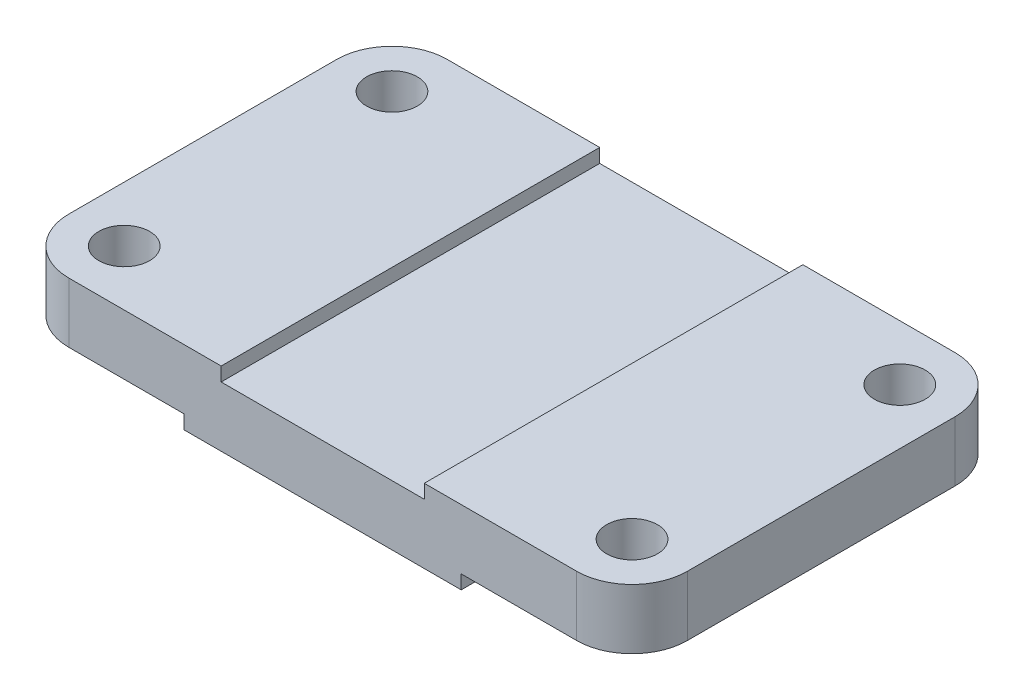
from build123d import *

# Parameters (mm, degrees)
EXTRUSION1_DEPTH   = 41
CONG_1_R           = 12
D_GAGEMENT_M1_61_D = 11


with BuildPart() as part:
    # Esquisse1 → Extrusion1 (new, symmetric)
    with BuildSketch(Plane.XY):
        Polygon((22, 16), (67, 16), (67, 3), (30, 3), (30, 0), (-30, 0), (-30, 3), (-67, 3), (-67, 16), (-22, 16), (-22, 13), (22, 13), align=None)
    extrude(amount=EXTRUSION1_DEPTH, both=True)

    # Congé1
    cong_1_edges = [part.edges().sort_by_distance(p)[0] for p in [
        (67, 9.5, -41),
        (-67, 9.5, -41),
        (67, 9.5, 41),
        (-67, 9.5, 41),
    ]]
    fillet(cong_1_edges, radius=CONG_1_R)

    # Dégagement M1.61 (through all)
    with Locations(Plane(origin=(0, 16, 0), x_dir=(-1, 0, 0), z_dir=(0, 1, 0))):
        with Locations((55, 29), (55, -29), (-55, -29), (-55, 29)):
            Hole(D_GAGEMENT_M1_61_D / 2)


solid = part.part
